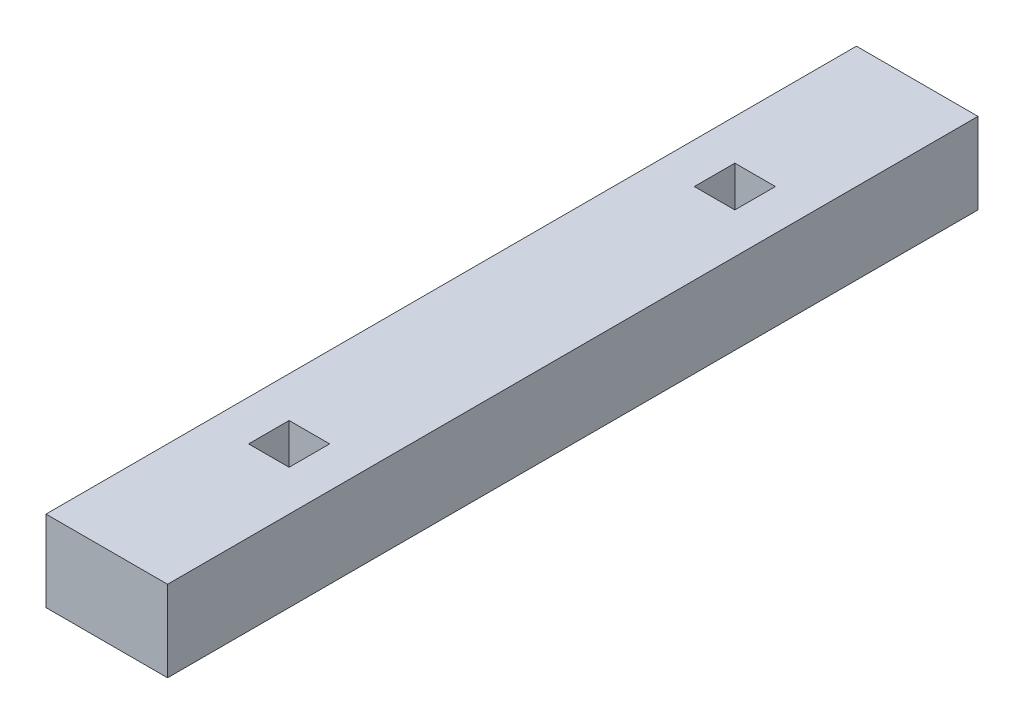
from build123d import *

# Parameters (mm, degrees)
SKETCH1_W           = 30
SKETCH1_H           = 200
SKETCH1_W_2         = 10
SKETCH1_H_2         = 10
BOSS_EXTRUDE1_DEPTH = 20


with BuildPart() as part:
    # Sketch1 → Boss-Extrude1 (new body)
    with BuildSketch(Plane(origin=(0, 0, 0), x_dir=(1, 0, 0), z_dir=(0, 1, 0))):
        with Locations((0, -5)):
            Rectangle(SKETCH1_W, SKETCH1_H)
        with Locations((0, 50)):
            Rectangle(SKETCH1_W_2, SKETCH1_H_2, mode=Mode.SUBTRACT)
        with Locations((0, -60)):
            Rectangle(SKETCH1_W_2, SKETCH1_H_2, mode=Mode.SUBTRACT)
    extrude(amount=BOSS_EXTRUDE1_DEPTH)


solid = part.part
